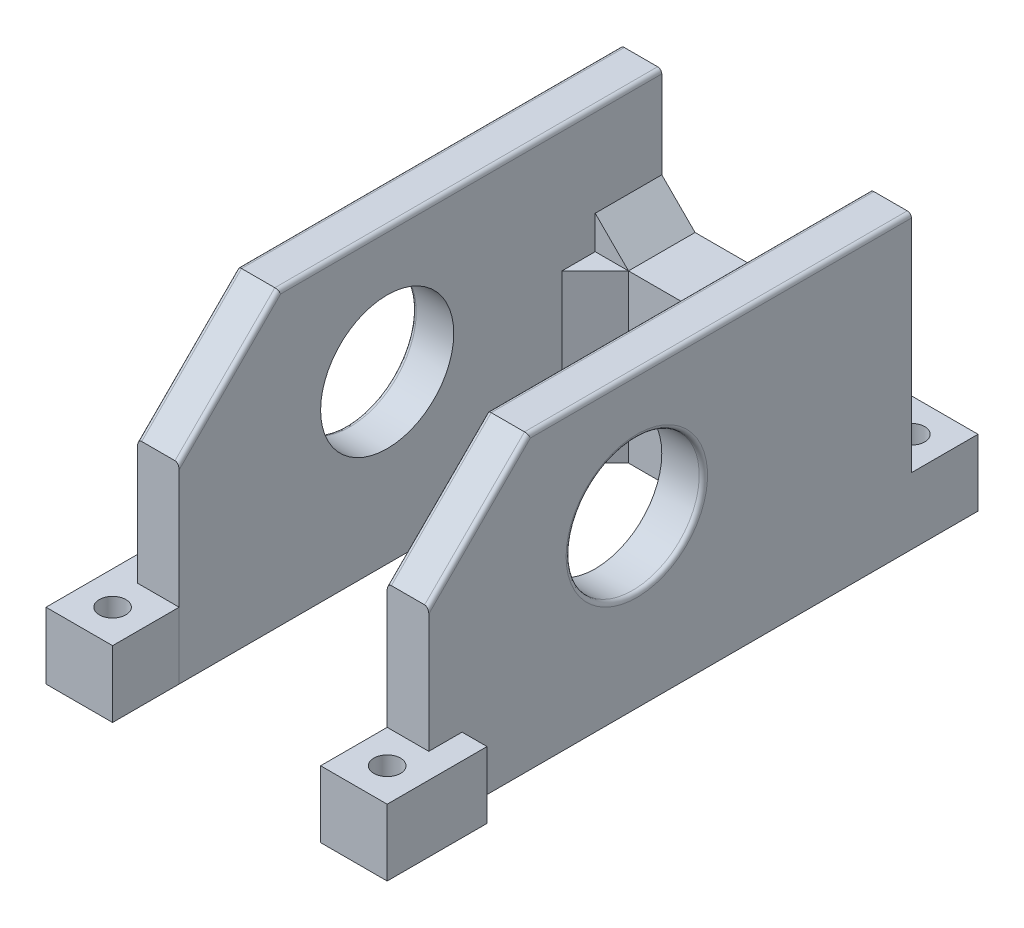
from build123d import *

# Parameters (mm, degrees)
ESQUISSE1_W             = 5
ESQUISSE1_H             = 58
BOSS_EXTRU_1_DEPTH      = 35
BOSS_EXTRU_1_2_DEPTH    = 35
BOSS_EXTRU_6_DEPTH      = 20
ESQUISSE1_6_W           = 8
ESQUISSE1_6_H           = 8
ESQUISSE1_6_R           = 1.6
BOSS_EXTRU_7_DEPTH      = 8
ESQUISSE1_8_R           = 1.6
BOSS_EXTRU_8_DEPTH      = 8
BOSS_EXTRU_8_2_DEPTH    = 8
ENL_V_MAT_EXTRU_3_DEPTH = 40
ESQUISSE6_R             = 8
ENL_V_MAT_EXTRU_4_DEPTH = 40
BOSS_EXTRU_9_DEPTH      = 8
CONG_1_R                = 0.5


with BuildPart() as part:
    # Esquisse1 → Boss.-Extru.1 (new body)
    with BuildSketch(Plane(origin=(0, 0, 0), x_dir=(1, 0, 0), z_dir=(0, 1, 0))):
        with Locations((-20.5, -20)):
            Rectangle(ESQUISSE1_W, ESQUISSE1_H)
    extrude(amount=BOSS_EXTRU_1_DEPTH)


with BuildPart() as body_2:
    # Esquisse1 → Boss.-Extru.1 2 (new body)
    with BuildSketch(Plane(origin=(0, 0, 0), x_dir=(1, 0, 0), z_dir=(0, 1, 0))):
        with Locations((9.5, -20)):
            Rectangle(ESQUISSE1_W, ESQUISSE1_H)
    extrude(amount=BOSS_EXTRU_1_2_DEPTH)


with BuildPart() as body_3:
    # Esquisse1<5> → Boss.-Extru.6 (new body)
    with BuildSketch(Plane(origin=(0, 0, 0), x_dir=(1, 0, 0), z_dir=(0, 1, 0))):
        Polygon((-18, 9), (-18, -3), (-14, 1), (3, 1), (7, -3), (7, 9), (4, 9), (-15, 9), align=None)
    extrude(amount=BOSS_EXTRU_6_DEPTH)

    # Esquisse1<6> → Boss.-Extru.7 (add)
    # profile 1 of 2: a face of its own
    with BuildSketch(Plane(origin=(0, 0, 0), x_dir=(1, 0, 0), z_dir=(0, 1, 0))):
        with Locations((-19, 13)):
            Rectangle(ESQUISSE1_6_W, ESQUISSE1_6_H)
        with Locations((-19, 13)):
            Circle(ESQUISSE1_6_R, mode=Mode.SUBTRACT)
    # profile 2 of 2: a face of its own
    with BuildSketch(Plane(origin=(0, 0, 0), x_dir=(1, 0, 0), z_dir=(0, 1, 0))):
        with Locations((8, 13)):
            Rectangle(ESQUISSE1_6_W, ESQUISSE1_6_H)
        with Locations((8, 13)):
            Circle(ESQUISSE1_6_R, mode=Mode.SUBTRACT)
    extrude(amount=BOSS_EXTRU_7_DEPTH)


with BuildPart() as body_4:
    # Esquisse1<8> → Boss.-Extru.8 (new body)
    with BuildSketch(Plane(origin=(0, 0, 0), x_dir=(1, 0, 0), z_dir=(0, 1, 0))):
        Polygon((-18, -57), (-18, -49), (-23, -49), (-23, -45), (-26, -45), (-26, -57), align=None)
        with Locations((-22, -53)):
            Circle(ESQUISSE1_8_R, mode=Mode.SUBTRACT)
    extrude(amount=BOSS_EXTRU_8_DEPTH)


with BuildPart() as body_5:
    # Esquisse1<8> → Boss.-Extru.8 2 (new body)
    with BuildSketch(Plane(origin=(0, 0, 0), x_dir=(1, 0, 0), z_dir=(0, 1, 0))):
        Polygon((12, -49), (7, -49), (7, -57), (15, -57), (15, -45), (12, -45), align=None)
        with Locations((11, -53)):
            Circle(ESQUISSE1_8_R, mode=Mode.SUBTRACT)
    extrude(amount=BOSS_EXTRU_8_2_DEPTH)


with BuildPart() as enl_v_mat_extru_3_tool:
    # Esquisse7 → Enlèv. mat.-Extru.3 (new body)
    with BuildSketch(Plane.ZY.offset(23)):
        Polygon((49, 35), (49, 23), (37, 35), align=None)
    extrude(amount=-ENL_V_MAT_EXTRU_3_DEPTH)


with BuildPart() as part_1:
    add(part.part)

    # Enlèv. mat.-Extru.3: cut by enl_v_mat_extru_3_tool
    add(enl_v_mat_extru_3_tool.part, mode=Mode.SUBTRACT)


with BuildPart() as body_2_1:
    add(body_2.part)

    # Enlèv. mat.-Extru.3: cut by enl_v_mat_extru_3_tool
    add(enl_v_mat_extru_3_tool.part, mode=Mode.SUBTRACT)


with BuildPart() as enl_v_mat_extru_4_tool:
    # Esquisse6 → Enlèv. mat.-Extru.4 (new body)
    with BuildSketch(Plane.ZY.offset(23)):
        with Locations((24, 20)):
            Circle(ESQUISSE6_R)
    extrude(amount=-ENL_V_MAT_EXTRU_4_DEPTH)


with BuildPart() as part_2:
    add(part_1.part)

    # Enlèv. mat.-Extru.4: cut by enl_v_mat_extru_4_tool
    add(enl_v_mat_extru_4_tool.part, mode=Mode.SUBTRACT)



with BuildPart() as body_2_2:
    add(body_2_1.part)

    # Enlèv. mat.-Extru.4: cut by enl_v_mat_extru_4_tool
    add(enl_v_mat_extru_4_tool.part, mode=Mode.SUBTRACT)


with BuildPart() as part_3:
    add(part_2.part)

    add(body_2_2.part)  # Boss.-Extru.9 merges body 2

    add(body_3.part)  # Boss.-Extru.9 merges body 3
    # Esquisse10 → Boss.-Extru.9 (add)
    with BuildSketch(Plane(origin=(0, 0, -9), x_dir=(-1, 0, 0), z_dir=(0, 0, -1))):
        Polygon((-7, 20), (-7, 24), (-3, 20), align=None)
        Polygon((18, 20), (14, 20), (18, 24), align=None)
    extrude(amount=-BOSS_EXTRU_9_DEPTH)

    # Congé1
    cong_1_edges = [part_3.edges().sort_by_distance(p)[0] for p in [
        (12, 20, 16),
        (-23, 20, 16),
        (-23, 29, 43),
        (-18, 29, 43),
        (7, 29, 43),
        (12, 29, 43),
        (-23, 35, 14),
        (-18, 35, 14),
        (7, 35, 14),
        (12, 35, 14),
    ]]
    fillet(cong_1_edges, radius=CONG_1_R)


solid = Compound([body_4.part, body_5.part, part_3.part])
